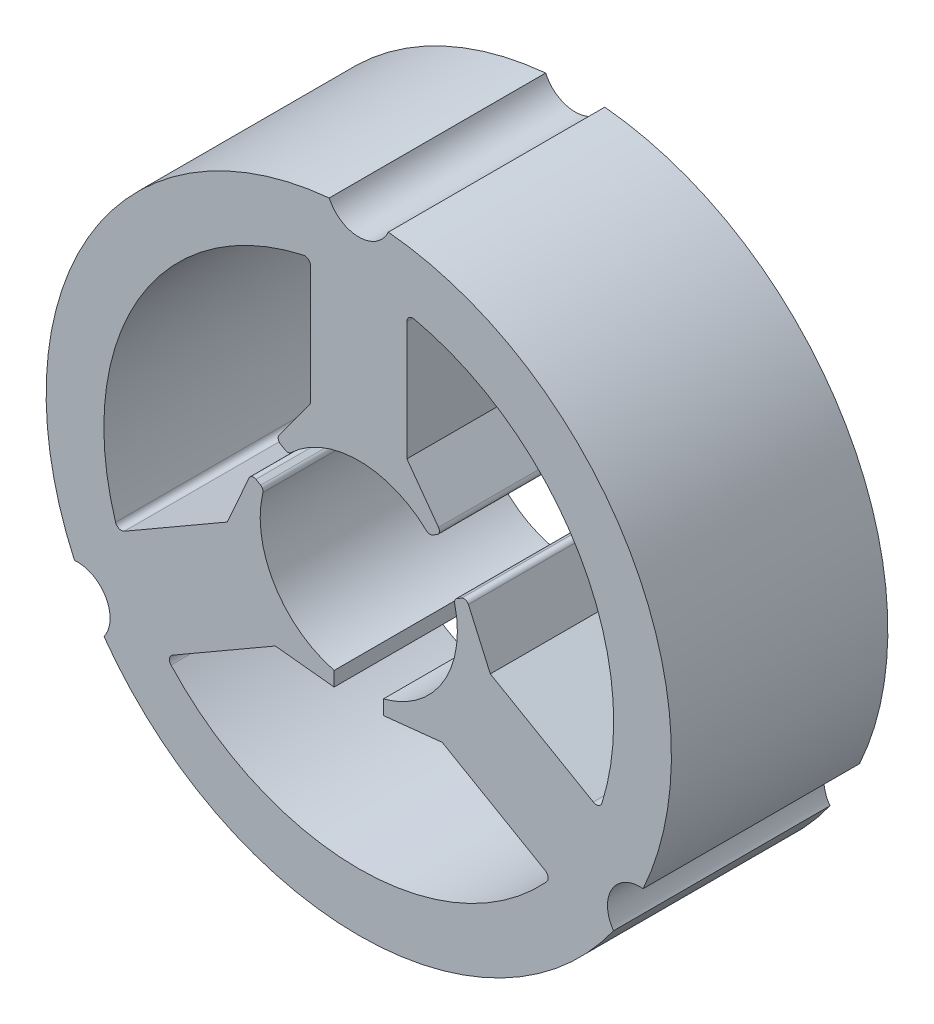
from build123d import *

# Parameters (mm, degrees)
SKETCH_1_R               = 4.1
EXTRUDE_1_DEPTH          = 9
CUT_EXTRUDE_1_DEPTH      = 10
PATTERN_CIRCULAR_1_COUNT = 3
FILLET_1_R               = 0.2


with BuildPart() as part:
    # 草图1 → 凸台-拉伸1 (new body)
    with BuildSketch(Plane.XY):
        with BuildLine():
            ThreePointArc((-1.229173411, 12.941759259), (-11.258330249, 6.5), (-11.822478994, -5.40638423))
            ThreePointArc((-11.822478994, -5.40638423), (-10.522208656, -6.075), (-10.593305582, -7.53537503))
            ThreePointArc((-10.593305582, -7.53537503), (0, -13), (10.593305582, -7.53537503))
            ThreePointArc((10.593305582, -7.53537503), (10.522208656, -6.075), (11.822478994, -5.40638423))
            ThreePointArc((11.822478994, -5.40638423), (11.258330249, 6.5), (1.229173411, 12.941759259))
            ThreePointArc((1.229173411, 12.941759259), (0, 12.15), (-1.229173411, 12.941759259))
        make_face()
        Circle(SKETCH_1_R, mode=Mode.SUBTRACT)
    extrude(amount=EXTRUDE_1_DEPTH)

    # 草图2 → 切除-拉伸1 (cut)
    with BuildSketch(Plane.XY):
        with BuildLine():
            Line((-7.748999943, -6.78328828), (-3.470031597, -4.312824754))
            Line((-3.470031597, -4.312824754), (-1.025, -4.56980793))
            Line((-1.025, -4.56980793), (-1.025, -3.96980793))
            ThreePointArc((-1.025, -3.96980793), (0, -4.1), (1.025, -3.96980793))
            Line((1.025, -3.96980793), (1.025, -4.56980793))
            Line((1.025, -4.56980793), (3.470031597, -4.312824754))
            Line((3.470031597, -4.312824754), (7.748999943, -6.78328828))
            ThreePointArc((7.748999943, -6.78328828), (7.871108829, -6.961884233), (7.808154531, -7.168871796))
            ThreePointArc((7.808154531, -7.168871796), (0, -10.6), (-7.808154531, -7.168871796))
            ThreePointArc((-7.808154531, -7.168871796), (-7.871108829, -6.961884233), (-7.748999943, -6.78328828))
        make_face()
    cut_extrude_1 = extrude(amount=CUT_EXTRUDE_1_DEPTH, mode=Mode.SUBTRACT)

    # 阵列(圆周)1: 切除-拉伸1 ×3 about axis
    pattern_circular_1_axis = Axis((0, 0, 0), (0, 0, 1))
    for i in range(1, PATTERN_CIRCULAR_1_COUNT):
        add(cut_extrude_1.rotate(pattern_circular_1_axis, i * 360 / PATTERN_CIRCULAR_1_COUNT), mode=Mode.SUBTRACT)

    # 圆角1
    fillet_1_edges = [part.edges().sort_by_distance(p)[0] for p in [
        (-4.470069758, 1.397227926, 4.5),
        (-3.445069758, 3.172580004, 4.5),
        (-2.925454515, 2.872580004, 4.5),
        (-3.950454515, 1.097227926, 4.5),
        (3.950454515, 1.097227926, 4.5),
        (2.925454515, 2.872580004, 4.5),
        (3.445069758, 3.172580004, 4.5),
        (4.470069758, 1.397227926, 4.5),
    ]]
    fillet(fillet_1_edges, radius=FILLET_1_R)


solid = part.part
